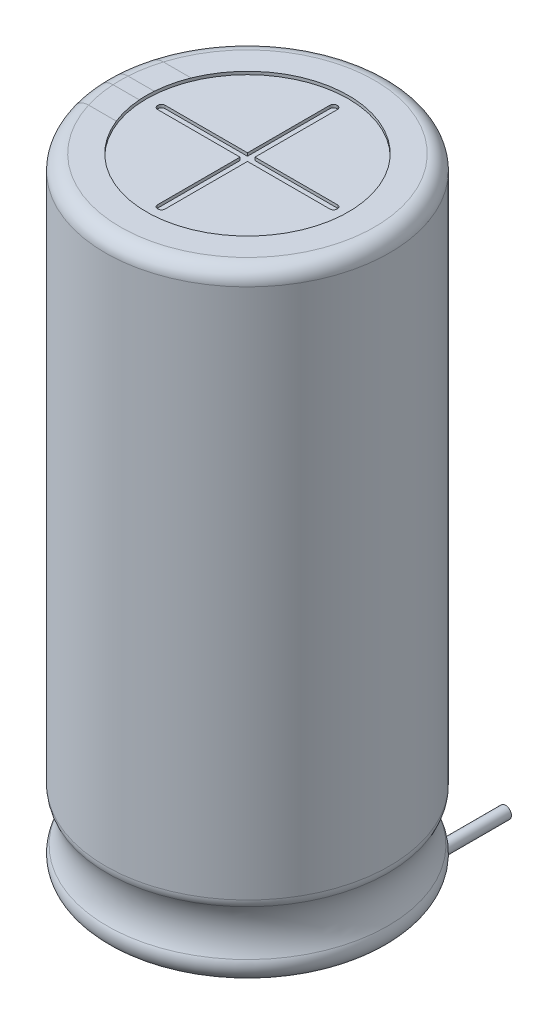
from build123d import *

# Parameters (mm, degrees)
SKETCH_3_R             = 6.75
CUT_EXTRUDE_1_DEPTH    = 0.2
CUT_EXTRUDE_2_DEPTH    = 0.2
SKETCH_5_R             = 7.3
CUT_EXTRUDE_3_DEPTH    = 0.2
EXTRUDE_1_DEPTH        = 1.2
SKETCH_11_R            = 0.4
PATTERN_LINEAR_1_COUNT = 2
PATTERN_LINEAR_1_PITCH = 7.5


with BuildPart() as part:
    # Эскиз2 → Повернуть1 (revolve)
    with BuildSketch(Plane.XY):
        with BuildLine():
            Line((0, 0), (8.5, 0))
            ThreePointArc((8.5, 0), (9.207106781, 0.292893219), (9.5, 1))
            ThreePointArc((9.5, 1), (9.4701425, 1.242535625), (9.382352941, 1.470588235))
            ThreePointArc((9.382352941, 1.470588235), (9, 3), (9.382352941, 4.529411765))
            ThreePointArc((9.382352941, 4.529411765), (9.4701425, 4.757464375), (9.5, 5))
            Line((9.5, 5), (9.5, 40.5))
            ThreePointArc((9.5, 40.5), (9.207106781, 41.207106781), (8.5, 41.5))
            Line((8.5, 41.5), (0, 41.5))
            Line((0, 41.5), (0, 0))
        make_face()
    revolve(axis=Axis((0, 0, 0), (0, 1, 0)))

    # Эскиз3 → Вырез-Вытянуть1 (cut)
    with BuildSketch(Plane(origin=(0, 41.5, 0), x_dir=(1, 0, 0), z_dir=(0, 1, 0))):
        with Locations(Location((0, 0, 0), (0, 0, 180))):
            Circle(SKETCH_3_R)
    extrude(amount=-CUT_EXTRUDE_1_DEPTH, mode=Mode.SUBTRACT)

    # Эскиз4 → Вырез-Вытянуть2 (cut)
    with BuildSketch(Plane(origin=(0, 41.3, 0), x_dir=(1, 0, 0), z_dir=(0, 1, 0))):
        with BuildLine():
            Line((-0.25, -0.25), (-0.25, -5.76))
            ThreePointArc((-0.25, -5.76), (-0.179705627, -5.929705627), (-0.01, -6))
            Line((-0.01, -6), (0.01, -6))
            ThreePointArc((0.01, -6), (0.179705627, -5.929705627), (0.25, -5.76))
            Line((0.25, -5.76), (0.25, -0.25))
            Line((0.25, -0.25), (5.76, -0.25))
            ThreePointArc((5.76, -0.25), (5.929705627, -0.179705627), (6, -0.01))
            Line((6, -0.01), (6, 0.01))
            ThreePointArc((6, 0.01), (5.929705627, 0.179705627), (5.76, 0.25))
            Line((5.76, 0.25), (0.25, 0.25))
            Line((0.25, 0.25), (0.25, 5.76))
            ThreePointArc((0.25, 5.76), (0.179705627, 5.929705627), (0.01, 6))
            Line((0.01, 6), (-0.01, 6))
            ThreePointArc((-0.01, 6), (-0.179705627, 5.929705627), (-0.25, 5.76))
            Line((-0.25, 5.76), (-0.25, 0.25))
            Line((-0.25, 0.25), (-5.76, 0.25))
            ThreePointArc((-5.76, 0.25), (-5.929705627, 0.179705627), (-6, 0.01))
            Line((-6, 0.01), (-6, -0.01))
            ThreePointArc((-6, -0.01), (-5.929705627, -0.179705627), (-5.76, -0.25))
            Line((-5.76, -0.25), (-0.25, -0.25))
        make_face()
    extrude(amount=-CUT_EXTRUDE_2_DEPTH, mode=Mode.SUBTRACT)

    # Эскиз5 → Вырез-Вытянуть3 (cut)
    with BuildSketch(Plane.XZ):
        Circle(SKETCH_5_R)
    extrude(amount=-CUT_EXTRUDE_3_DEPTH, mode=Mode.SUBTRACT)

    # Эскиз6 → Бобышка-Вытянуть1 (add)
    with BuildSketch(Plane.XZ.offset(-0.2)):
        with BuildLine():
            Line((-5.337602458, 2), (5.337602458, 2))
            ThreePointArc((5.337602458, 2), (0, 5.7), (-5.337602458, 2))
        make_face()
        with BuildLine():
            Line((-5.337602458, -2), (5.337602458, -2))
            ThreePointArc((5.337602458, -2), (0, -5.7), (-5.337602458, -2))
        make_face()
    extrude(amount=EXTRUDE_1_DEPTH)

    # По траектории3: sweep along a path in Эскиз10
    with BuildLine(Plane(origin=(-3.75, 0, 0), x_dir=(0, 0, -1), z_dir=(1, 0, 0))) as sweep_3_path:
        Line((0, 0.2), (0, 0))
        ThreePointArc((0, 0), (0.439339828, -1.060660172), (1.5, -1.5))
        Line((1.5, -1.5), (13.5, -1.5))
    # Эскиз11 → По траектории3 (sweep)
    with BuildSketch(Plane(origin=(-3.75, -1.5, -13.5), x_dir=(-1, 0, 0), z_dir=(0, 0, -1))):
        Circle(SKETCH_11_R)
    sweep_3 = sweep(path=sweep_3_path.line)

    # Линейный массив1: По траектории3 ×2
    with Locations(*[(i * PATTERN_LINEAR_1_PITCH, 0, 0) for i in range(1, PATTERN_LINEAR_1_COUNT)]):
        add(sweep_3)


solid = part.part
